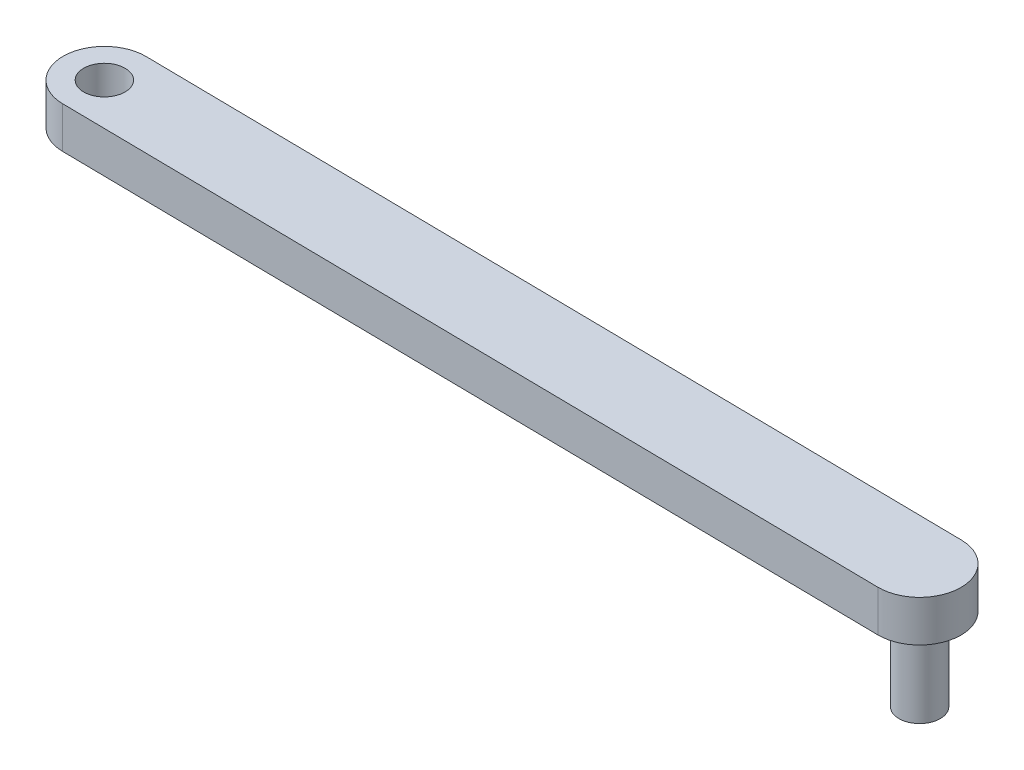
from build123d import *

# Parameters (mm, degrees)
SKETCH1_R           = 2.5
BOSS_EXTRUDE1_DEPTH = 5
SKETCH2_R           = 2.5
BOSS_EXTRUDE2_DEPTH = 15


with BuildPart() as part:
    # Sketch1 → Boss-Extrude1 (new body)
    with BuildSketch(Plane(origin=(0, 0, 0), x_dir=(1, 0, 0), z_dir=(0, 1, 0))):
        with BuildLine():
            Line((-14.504443595, 6.706697569), (85.495556405, 5.363127511))
            ThreePointArc((85.495556405, 5.363127511), (90.42793273, 0.296406305), (85.361211524, -4.635970021))
            Line((85.361211524, -4.635970021), (-14.638788476, -3.292399963))
            ThreePointArc((-14.638788476, -3.292399963), (-19.571164802, 1.774321243), (-14.504443595, 6.706697569))
        make_face()
        with Locations(Location((-14.571616036, 1.707148803, 0), (0, 0, 270))):
            Circle(SKETCH1_R, mode=Mode.SUBTRACT)
    extrude(amount=BOSS_EXTRUDE1_DEPTH)

    # Sketch2 → Boss-Extrude2 (add)
    with BuildSketch(Plane(origin=(0, 5, 0), x_dir=(1, 0, 0), z_dir=(0, 1, 0))):
        with Locations(Location((85.428383964, 0.363578745, 0), (0, 0, 270))):
            Circle(SKETCH2_R)
    extrude(amount=-BOSS_EXTRUDE2_DEPTH)


solid = part.part
